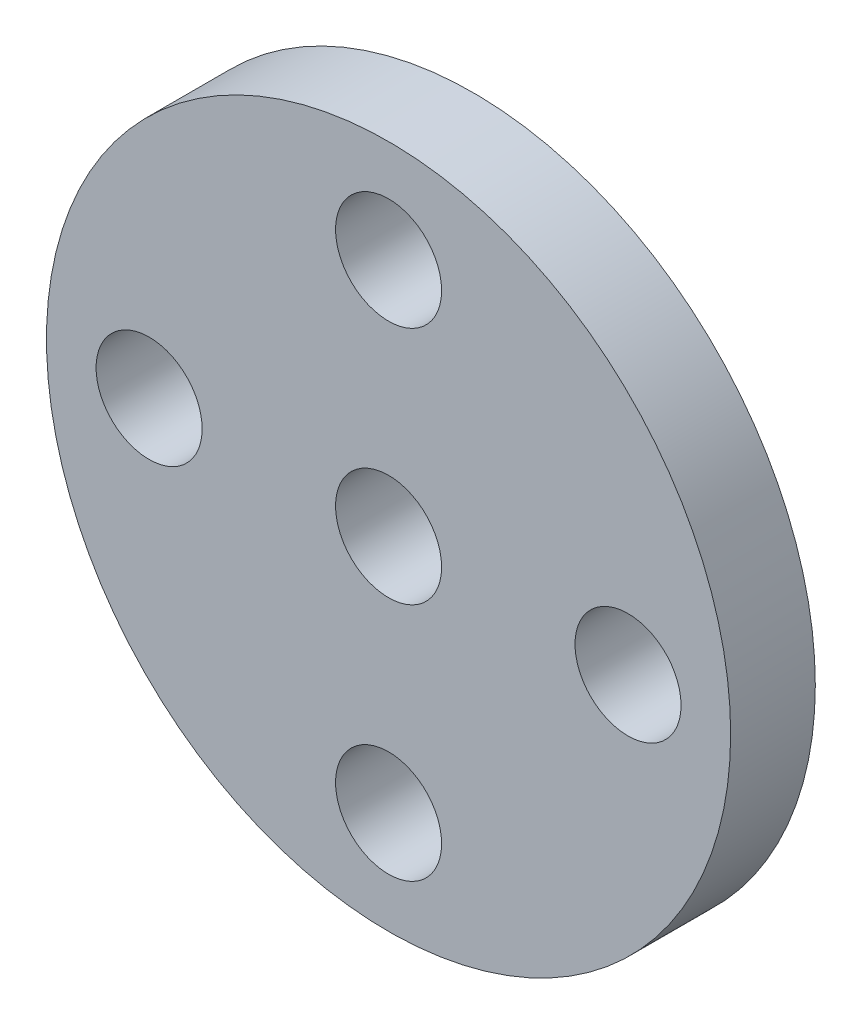
from build123d import *

# Parameters (mm, degrees)
SKETCH_1_R      = 10.101525446
SKETCH_1_R_2    = 1.565736444
EXTRUDE_1_DEPTH = 2.5
SKETCH_2_R      = 4.5
SKETCH_2_R_2    = 3
EXTRUDE_2_DEPTH = 2


with BuildPart() as part:
    # 草图1 → 凸台-拉伸1 (new body)
    with BuildSketch(Plane.XY):
        Circle(SKETCH_1_R)
        Circle(SKETCH_1_R_2, mode=Mode.SUBTRACT)
        with Locations((7.071067812, 0)):
            Circle(SKETCH_1_R_2, mode=Mode.SUBTRACT)
        with Locations((-7.071067812, 0)):
            Circle(SKETCH_1_R_2, mode=Mode.SUBTRACT)
        with Locations((0, 7.071067812)):
            Circle(SKETCH_1_R_2, mode=Mode.SUBTRACT)
        with Locations((0, -7.071067812)):
            Circle(SKETCH_1_R_2, mode=Mode.SUBTRACT)
    extrude(amount=EXTRUDE_1_DEPTH)

    # 草图2 → 凸台-拉伸2 (add)
    with BuildSketch(Plane(origin=(0, 0, 0), x_dir=(-1, 0, 0), z_dir=(0, 0, -1))):
        Circle(SKETCH_2_R)
        Circle(SKETCH_2_R_2, mode=Mode.SUBTRACT)
    extrude(amount=EXTRUDE_2_DEPTH)


solid = part.part
